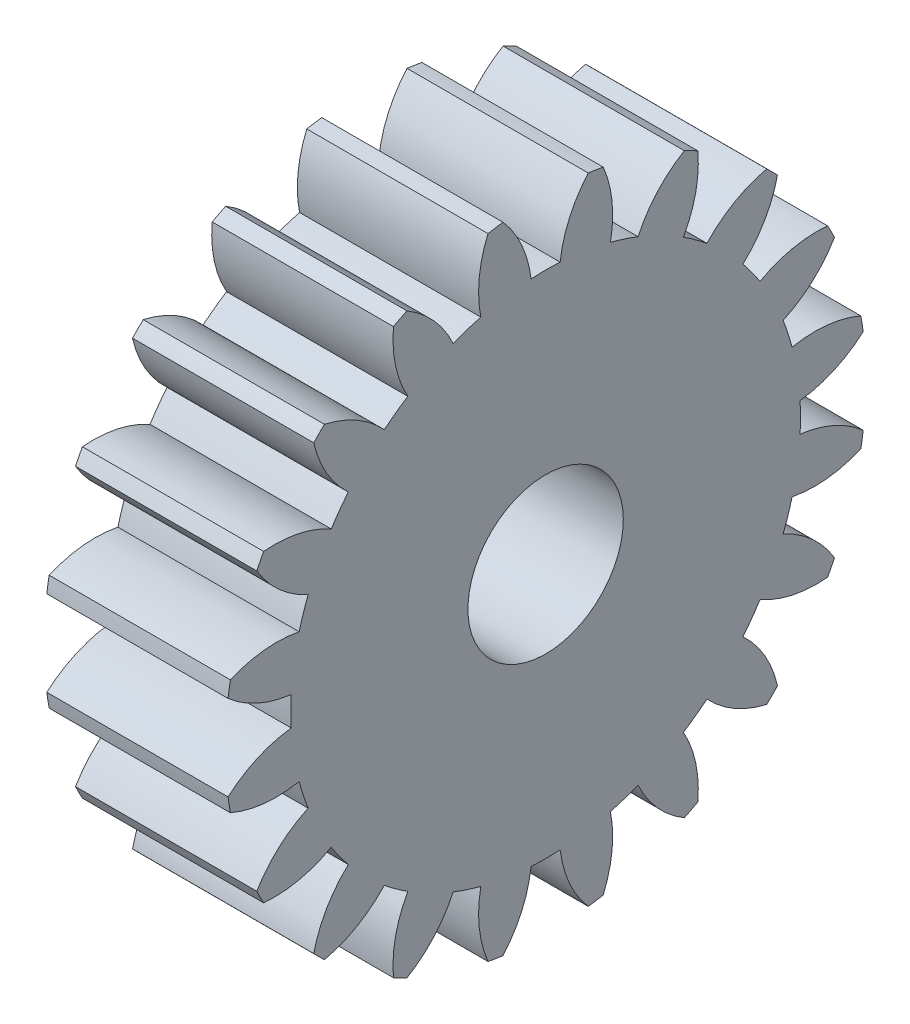
from build123d import *

# Parameters (mm, degrees)
BASPROSKE_W         = 7
BASPROSKE_H         = 12.375
TOOTHCUT_DEPTH      = 19.848905804
TEETHCUTS_COUNT     = 20
BORSKE_R            = 3
BORE_DEPTH          = 50.0000508
SKETCH1_R           = 3
BOSS_EXTRUDE1_DEPTH = 7
CUT_EXTRUDE1_DEPTH  = 7
SKETCH3_R           = 3
CUT_EXTRUDE2_DEPTH  = 7


with BuildPart() as part:
    # BasProSke → Base-Revolve (revolve)
    with BuildSketch(Plane(origin=(0, 0, 0), x_dir=(1, 0, 0), z_dir=(0, 1, 0)), mode=Mode.PRIVATE) as base_revolve_sk:
        with Locations((3.5, 6.1875)):
            Rectangle(BASPROSKE_W, BASPROSKE_H)
    revolve(base_revolve_sk.sketch.rotate(Axis((-10, 0, 0), (1, 0, 0)), 180), axis=Axis((-10, 0, 0), (1, 0, 0)))

    # TooCutSke → ToothCut (cut, through all)
    with BuildSketch(Plane(origin=(0, 0, 0), x_dir=(0, 0, -1), z_dir=(1, 0, 0))):
        with BuildLine():
            ThreePointArc((0.561279811, 9.826733564), (0, 9.84275), (-0.561279811, 9.826733564))
            ThreePointArc((-0.561279811, 9.826733564), (-0.925277854, 11.14210546), (-1.666860651, 12.287859689))
            ThreePointArc((-1.666860651, 12.287859689), (0, 12.4004), (1.666860651, 12.287859689))
            ThreePointArc((1.666860651, 12.287859689), (0.925277854, 11.14210546), (0.561279811, 9.826733564))
        make_face()
    toothcut = extrude(amount=TOOTHCUT_DEPTH, mode=Mode.SUBTRACT)

    # TeethCuts: ToothCut ×20 about axis
    teethcuts_axis = Axis((0, 0, 0), (1, 0, 0))
    for i in range(1, TEETHCUTS_COUNT):
        add(toothcut.rotate(teethcuts_axis, i * 360 / TEETHCUTS_COUNT), mode=Mode.SUBTRACT)

    # BorSke → Bore (cut, symmetric)
    with BuildSketch(Plane(origin=(0, 0, 0), x_dir=(0, 0, -1), z_dir=(1, 0, 0))):
        with Locations(Location((0, 0, 0), (0, 0, 180))):
            Circle(BORSKE_R)
    extrude(amount=BORE_DEPTH, both=True, mode=Mode.SUBTRACT)

    # Sketch1 → Boss-Extrude1 (add)
    with BuildSketch(Plane(origin=(7, 0, 0), x_dir=(0, 0, -1), z_dir=(1, 0, 0))):
        Circle(SKETCH1_R)
    extrude(amount=-BOSS_EXTRUDE1_DEPTH)

    # Sketch2 → Cut-Extrude1 (cut)
    with BuildSketch(Plane(origin=(7, 0, 0), x_dir=(0, 0, -1), z_dir=(1, 0, 0))):
        with BuildLine():
            ThreePointArc((1.8, 2.01246118), (0, 2.7), (-1.8, 2.01246118))
            Line((-1.8, 2.01246118), (-1.8, 0))
            Line((-1.8, 0), (1.8, 0))
            Line((1.8, 0), (1.8, 2.01246118))
        make_face()
        with BuildLine():
            Line((1.8, 0), (-1.8, 0))
            Line((-1.8, 0), (-1.8, -2.01246118))
            ThreePointArc((-1.8, -2.01246118), (0, -2.7), (1.8, -2.01246118))
            Line((1.8, -2.01246118), (1.8, 0))
        make_face()
    extrude(amount=-CUT_EXTRUDE1_DEPTH, mode=Mode.SUBTRACT)

    # Sketch3 → Cut-Extrude2 (cut)
    with BuildSketch(Plane(origin=(7, 0, 0), x_dir=(0, 0, -1), z_dir=(1, 0, 0))):
        Circle(SKETCH3_R)
    extrude(amount=-CUT_EXTRUDE2_DEPTH, mode=Mode.SUBTRACT)


solid = part.part
